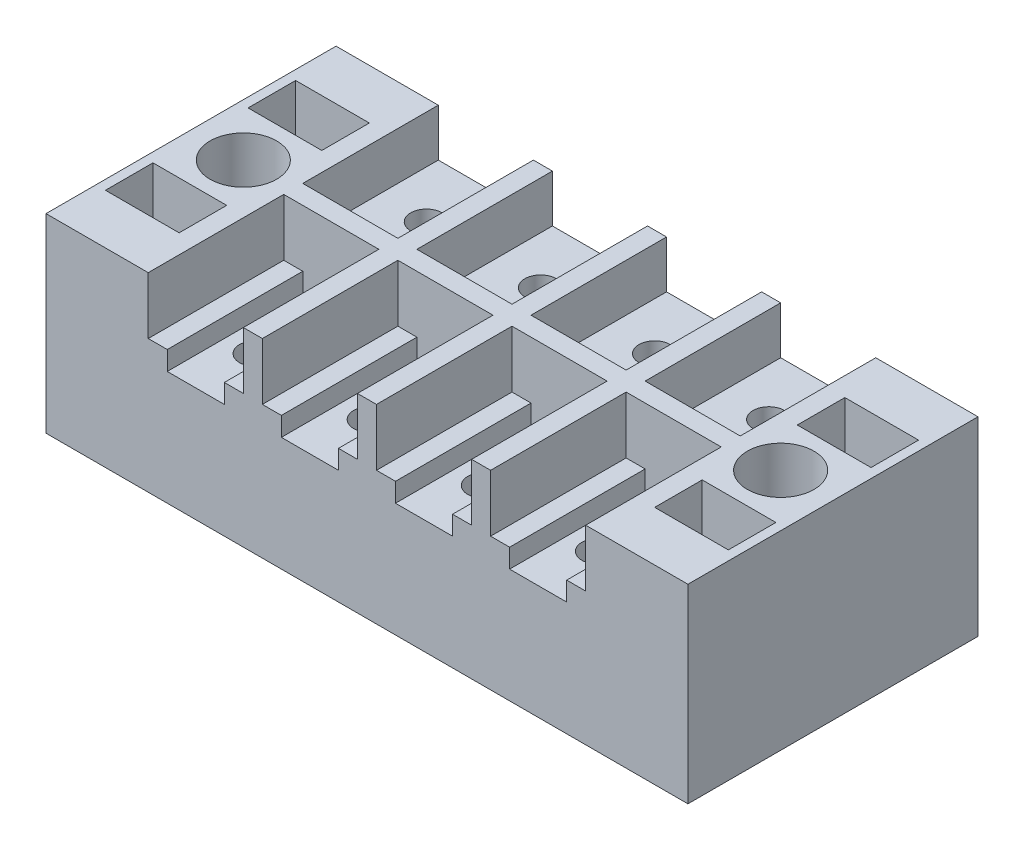
from build123d import *

# Parameters (mm, degrees)
SKETCH_1_W             = 67.5
SKETCH_1_H             = 30.5
SKETCH_1_W_2           = 7.75
SKETCH_1_H_2           = 5
EXTRUDE_1_DEPTH        = 20
SKETCH_1_3_R           = 3.5
CUT_EXTRUDE_1_DEPTH    = 13
SKETCH_1_4_R           = 2.1
CUT_EXTRUDE_2_DEPTH    = 43.090675927
SKETCH_1_5_W           = 10
SKETCH_1_5_H           = 14.25
CUT_EXTRUDE_3_DEPTH    = 6
SKETCH_1_6_W           = 10
SKETCH_1_6_H           = 14.25
CUT_EXTRUDE_4_DEPTH    = 5
SKETCH_2_W             = 6
SKETCH_2_H             = 2
CUT_EXTRUDE_5_DEPTH    = 14.25
SKETCH_3_W             = 46
SKETCH_3_H             = 10
SKETCH_3_R             = 3.5
CUT_EXTRUDE_6_DEPTH    = 7.5
SKETCH_3_3_W           = 46
SKETCH_3_3_H           = 5.1
CUT_EXTRUDE_7_DEPTH    = 9.5
SKETCH_4_W             = 8
SKETCH_4_H             = 10
EXTRUDE_2_DEPTH        = 2.5
HOLE_WIZARD_M4_1_D     = 3.3
HOLE_WIZARD_M4_1_DEPTH = 10.1
HOLE_WIZARD_M4_1_TIP   = 0.991420021


with BuildPart() as part:
    # 草图1 → 凸台-拉伸1 (new body)
    with BuildSketch(Plane(origin=(0, 0, 0), x_dir=(1, 0, 0), z_dir=(0, 1, 0))):
        Rectangle(SKETCH_1_W, SKETCH_1_H)
        with Locations((-28.875, -7.5)):
            Rectangle(SKETCH_1_W_2, SKETCH_1_H_2, mode=Mode.SUBTRACT)
        with Locations((-28.875, 7.5)):
            Rectangle(SKETCH_1_W_2, SKETCH_1_H_2, mode=Mode.SUBTRACT)
        with Locations((28.875, 7.5)):
            Rectangle(SKETCH_1_W_2, SKETCH_1_H_2, mode=Mode.SUBTRACT)
        with Locations((28.875, -7.5)):
            Rectangle(SKETCH_1_W_2, SKETCH_1_H_2, mode=Mode.SUBTRACT)
    extrude(amount=-EXTRUDE_1_DEPTH)

    # 草图1<3> → 切除-拉伸1 (cut)
    with BuildSketch(Plane(origin=(0, 0, 0), x_dir=(1, 0, 0), z_dir=(0, 1, 0))):
        with Locations(Location((-28.25, 0, 0), (0, 0, 270))):
            Circle(SKETCH_1_3_R)
        with Locations(Location((28.25, 0, 0), (0, 0, 270))):
            Circle(SKETCH_1_3_R)
    extrude(amount=-CUT_EXTRUDE_1_DEPTH, mode=Mode.SUBTRACT)

    # 草图1<4> → 切除-拉伸2 (cut, through all)
    with BuildSketch(Plane(origin=(0, 0, 0), x_dir=(1, 0, 0), z_dir=(0, 1, 0))):
        with Locations(Location((-28.25, 0, 0), (0, 0, 270))):
            Circle(SKETCH_1_4_R)
        with Locations(Location((28.25, 0, 0), (0, 0, 90))):
            Circle(SKETCH_1_4_R)
    extrude(amount=-CUT_EXTRUDE_2_DEPTH, mode=Mode.SUBTRACT)

    # 草图1<5> → 切除-拉伸3 (cut)
    with BuildSketch(Plane(origin=(0, 0, 0), x_dir=(1, 0, 0), z_dir=(0, 1, 0))):
        with Locations((-18, -8.125)):
            Rectangle(SKETCH_1_5_W, SKETCH_1_5_H)
        with Locations((-6, -8.125)):
            Rectangle(SKETCH_1_5_W, SKETCH_1_5_H)
        with Locations((6, -8.125)):
            Rectangle(SKETCH_1_5_W, SKETCH_1_5_H)
        with Locations((18, -8.125)):
            Rectangle(SKETCH_1_5_W, SKETCH_1_5_H)
    extrude(amount=-CUT_EXTRUDE_3_DEPTH, mode=Mode.SUBTRACT)

    # 草图1<6> → 切除-拉伸4 (cut)
    with BuildSketch(Plane(origin=(0, 0, 0), x_dir=(1, 0, 0), z_dir=(0, 1, 0))):
        with Locations((-18, 8.125)):
            Rectangle(SKETCH_1_6_W, SKETCH_1_6_H)
        with Locations((-6, 8.125)):
            Rectangle(SKETCH_1_6_W, SKETCH_1_6_H)
        with Locations((6, 8.125)):
            Rectangle(SKETCH_1_6_W, SKETCH_1_6_H)
        with Locations((18, 8.125)):
            Rectangle(SKETCH_1_6_W, SKETCH_1_6_H)
    extrude(amount=-CUT_EXTRUDE_4_DEPTH, mode=Mode.SUBTRACT)

    # 草图2 → 切除-拉伸5 (cut)
    with BuildSketch(Plane.XY.offset(15.25)):
        with Locations((-6, -7)):
            Rectangle(SKETCH_2_W, SKETCH_2_H)
        with Locations((-18, -7)):
            Rectangle(SKETCH_2_W, SKETCH_2_H)
        with Locations((6, -7)):
            Rectangle(SKETCH_2_W, SKETCH_2_H)
        with Locations((18, -7)):
            Rectangle(SKETCH_2_W, SKETCH_2_H)
    extrude(amount=-CUT_EXTRUDE_5_DEPTH, mode=Mode.SUBTRACT)

    # 草图3 → 切除-拉伸6 (cut)
    # profile 1 of 2: a face of its own
    with BuildSketch(Plane.XZ.offset(20)):
        with Locations((0, 8.75)):
            Rectangle(SKETCH_3_W, SKETCH_3_H)
        with Locations(Location((18, 9.25, 0), (0, 0, 270))):
            Circle(SKETCH_3_R, mode=Mode.SUBTRACT)
        with Locations(Location((6, 9.25, 0), (0, 0, 270))):
            Circle(SKETCH_3_R, mode=Mode.SUBTRACT)
        with Locations(Location((-6, 9.25, 0), (0, 0, 270))):
            Circle(SKETCH_3_R, mode=Mode.SUBTRACT)
        with Locations(Location((-18, 9.25, 0), (0, 0, 270))):
            Circle(SKETCH_3_R, mode=Mode.SUBTRACT)
    # profile 2 of 2: a face of its own
    with BuildSketch(Plane.XZ.offset(20)):
        with Locations((0, -8.75)):
            Rectangle(SKETCH_3_W, SKETCH_3_H)
        with Locations(Location((-18, -8.25, 0), (0, 0, 270))):
            Circle(SKETCH_3_R, mode=Mode.SUBTRACT)
        with Locations(Location((18, -8.25, 0), (0, 0, 270))):
            Circle(SKETCH_3_R, mode=Mode.SUBTRACT)
        with Locations(Location((6, -8.25, 0), (0, 0, 270))):
            Circle(SKETCH_3_R, mode=Mode.SUBTRACT)
        with Locations(Location((-6, -8.25, 0), (0, 0, 270))):
            Circle(SKETCH_3_R, mode=Mode.SUBTRACT)
    extrude(amount=-CUT_EXTRUDE_6_DEPTH, mode=Mode.SUBTRACT)

    # 草图3<3> → 切除-拉伸7 (cut)
    with BuildSketch(Plane.XZ.offset(20)):
        Rectangle(SKETCH_3_3_W, SKETCH_3_3_H)
    extrude(amount=-CUT_EXTRUDE_7_DEPTH, mode=Mode.SUBTRACT)

    # 草图4 → 凸台-拉伸2 (add)
    with BuildSketch(Plane.XZ.offset(12.5)):
        with Locations((-18, 8.75)):
            Rectangle(SKETCH_4_W, SKETCH_4_H)
        with Locations((-6, 8.75)):
            Rectangle(SKETCH_4_W, SKETCH_4_H)
        with Locations((6, 8.75)):
            Rectangle(SKETCH_4_W, SKETCH_4_H)
        with Locations((18, 8.75)):
            Rectangle(SKETCH_4_W, SKETCH_4_H)
        with Locations((-6, -8.75)):
            Rectangle(SKETCH_4_W, SKETCH_4_H)
        with Locations((6, -8.75)):
            Rectangle(SKETCH_4_W, SKETCH_4_H)
        with Locations((18, -8.75)):
            Rectangle(SKETCH_4_W, SKETCH_4_H)
        with Locations((-18, -8.75)):
            Rectangle(SKETCH_4_W, SKETCH_4_H)
    extrude(amount=EXTRUDE_2_DEPTH)

    # M4 螺纹孔1
    with Locations(Plane(origin=(0, -5, 0), x_dir=(1, 0, 0), z_dir=(0, 1, 0))):
        with Locations((-18, 9), (-6, 9), (6, 9), (18, 9), (18, -9), (6, -9), (-6, -9), (-18, -9)):
            Hole(HOLE_WIZARD_M4_1_D / 2, depth=HOLE_WIZARD_M4_1_DEPTH)
            with Locations((0, 0, -(HOLE_WIZARD_M4_1_DEPTH + HOLE_WIZARD_M4_1_TIP / 2))):  # 118° drill point
                Cone(0, HOLE_WIZARD_M4_1_D / 2, HOLE_WIZARD_M4_1_TIP, mode=Mode.SUBTRACT)


solid = part.part
